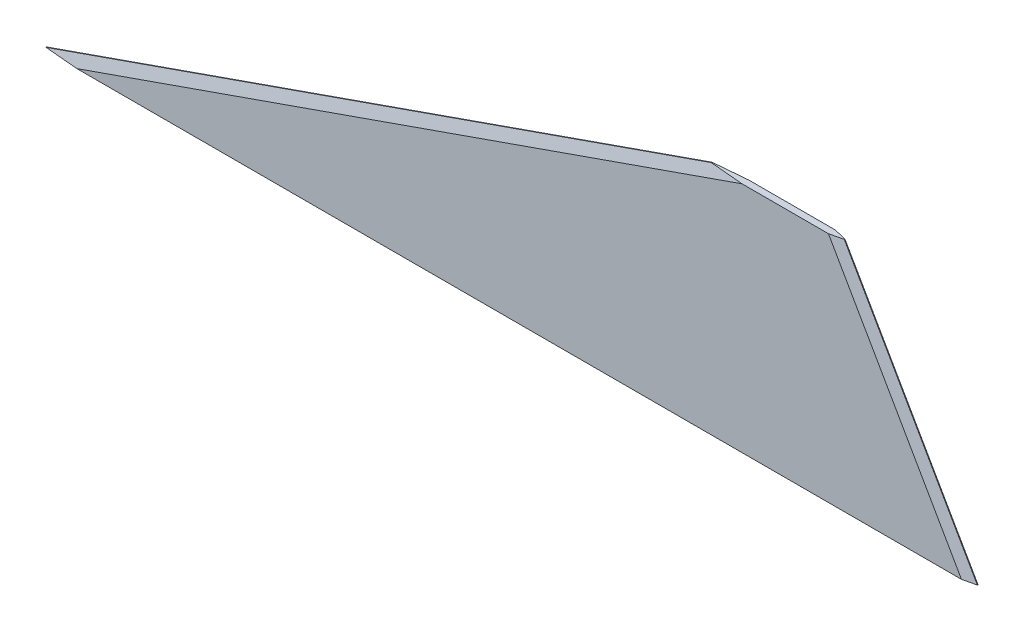
from build123d import *
from OCP.BRepFilletAPI import BRepFilletAPI_MakeChamfer

# Parameters (mm, degrees)
BOSS_EXTRUDE1_DEPTH = 2.54
CHAMFER2_SIZE       = 1.143
CHAMFER2_SIZE2      = 4.265734073


with BuildPart() as part:
    # Sketch1 → Boss-Extrude1 (new body)
    with BuildSketch(Plane.XY):
        Polygon((0, 0), (355.6, 0), (304.8, 88.9), (254, 88.9), align=None)
    extrude(amount=BOSS_EXTRUDE1_DEPTH)

    # Chamfer2: one chamfer whose edges measure the first distance from different faces: ONE call of the kernel's chamfer builder (chamfer() names one face for all edges)
    chamfer2_edges_1 = [part.edges().sort_by_distance(p)[0] for p in [
        (330.2, 44.45, 2.54),
        (330.2, 44.45, 0),
    ]]
    chamfer2_side_1 = [part.faces().sort_by_distance(p)[0] for p in [
        (330.2, 44.45, 1.27),
    ]]
    chamfer2_edges_2 = [part.edges().sort_by_distance(p)[0] for p in [
        (127, 44.45, 2.54),
        (127, 44.45, 0),
    ]]
    chamfer2_side_2 = [part.faces().sort_by_distance(p)[0] for p in [
        (127, 44.45, 1.27),
    ]]
    chamfer2 = BRepFilletAPI_MakeChamfer(part.part.solid().wrapped)
    for e in chamfer2_edges_1:
        chamfer2.Add(CHAMFER2_SIZE, CHAMFER2_SIZE2, e.wrapped, chamfer2_side_1[0].wrapped)  # the first distance lies on this face
    for e in chamfer2_edges_2:
        chamfer2.Add(CHAMFER2_SIZE, CHAMFER2_SIZE2, e.wrapped, chamfer2_side_2[0].wrapped)  # the first distance lies on this face
    add(Compound.cast(chamfer2.Shape()), mode=Mode.REPLACE)


solid = part.part
